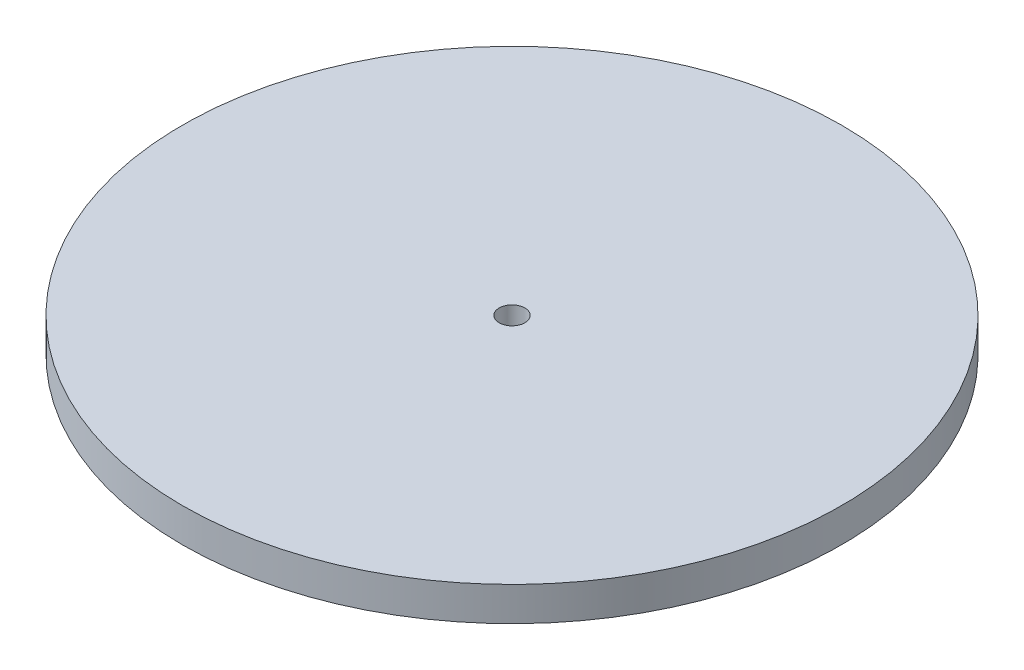
from build123d import *

# Parameters (mm, degrees)
SKETCH1_R       = 64
SKETCH1_R_2     = 2.5
PROP_DISC_DEPTH = 6.6


with BuildPart() as part:
    # Sketch1 → Prop disc (new body)
    with BuildSketch(Plane(origin=(0, 0, 0), x_dir=(1, 0, 0), z_dir=(0, 1, 0))):
        with Locations(Location((0, 0, 0), (0, 0, 270))):
            Circle(SKETCH1_R)
        with Locations(Location((0, 0, 0), (0, 0, 270))):
            Circle(SKETCH1_R_2, mode=Mode.SUBTRACT)
    extrude(amount=PROP_DISC_DEPTH)


solid = part.part
